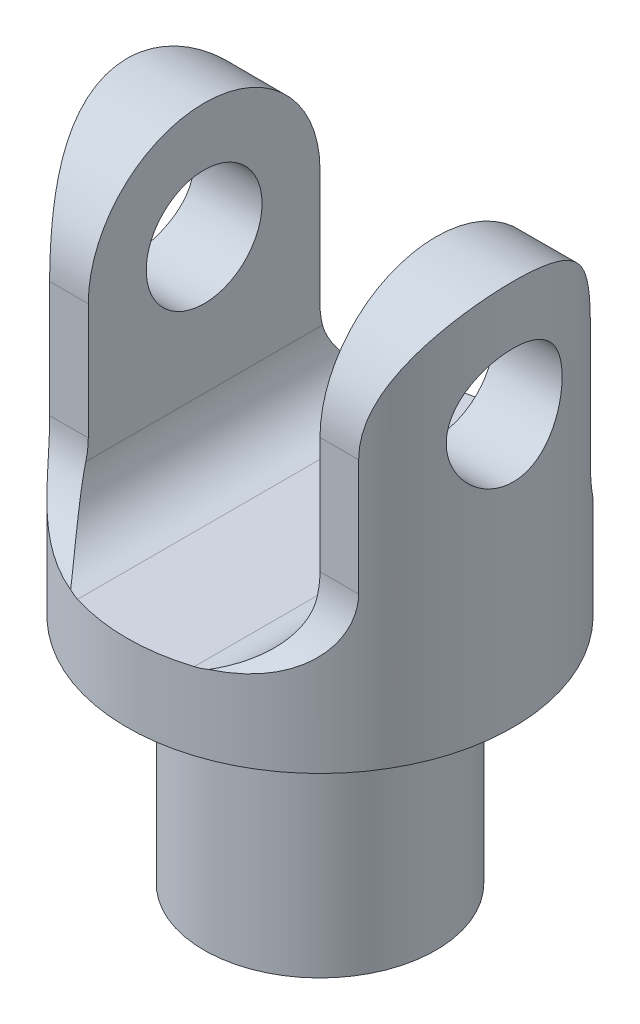
from build123d import *

# Parameters (mm, degrees)
CORTAR_EXTRUIR1_DEPTH      = 5
CORTAR_EXTRUIR1_DEPTH_BACK = 5
CROQUIS2_R                 = 1.5
CORTAR_EXTRUIR2_DEPTH      = 5
CORTAR_EXTRUIR2_DEPTH_BACK = 5


with BuildPart() as part:
    # Croquis1 → Revolución1 (revolve)
    with BuildSketch(Plane.XY):
        Polygon((3, 5), (5, 5), (5, -5), (3, -5), (3, -11), (0, -11), (0, -3), (0, 5), align=None)
    revolve(axis=Axis((0, -3, 0), (0, -1, 0)))

    # Croquis2 → Cortar-Extruir1 (cut, two sides: drawn at the far end of the back side and taken through both)
    with BuildSketch(Plane(origin=(0, 0, 0), x_dir=(0, 0, -1), z_dir=(1, 0, 0)).offset(-CORTAR_EXTRUIR1_DEPTH_BACK)):
        with BuildLine():
            Line((-5, 5), (-5, -3))
            Line((-5, -3), (-4.99, -3))
            ThreePointArc((-4.99, -3), (-3.582857505, -2.417142495), (-3, -1.01))
            Line((-3, -1.01), (-3, 2))
            ThreePointArc((-3, 2), (-2.121320344, 4.121320344), (0, 5))
            Line((0, 5), (-5, 5))
        make_face()
        with BuildLine():
            Line((5, 5), (0, 5))
            ThreePointArc((0, 5), (2.121320344, 4.121320344), (3, 2))
            Line((3, 2), (3, -1.01))
            ThreePointArc((3, -1.01), (3.582857505, -2.417142495), (4.99, -3))
            Line((4.99, -3), (5, -3))
            Line((5, -3), (5, 5))
        make_face()
        with Locations((0, 2)):
            Circle(CROQUIS2_R)
    extrude(amount=CORTAR_EXTRUIR1_DEPTH + CORTAR_EXTRUIR1_DEPTH_BACK, mode=Mode.SUBTRACT)

    # Croquis3 → Cortar-Extruir2 (cut, two sides: drawn at the far end of the back side and taken through both)
    with BuildSketch(Plane.XY.offset(-CORTAR_EXTRUIR2_DEPTH_BACK)):
        with BuildLine():
            Line((3, -1.51), (3, 5))
            Line((3, 5), (-3, 5))
            Line((-3, 5), (-3, -1.51))
            ThreePointArc((-3, -1.51), (-2.563589104, -2.563589104), (-1.51, -3))
            Line((-1.51, -3), (1.51, -3))
            ThreePointArc((1.51, -3), (2.563589104, -2.563589104), (3, -1.51))
        make_face()
    extrude(amount=CORTAR_EXTRUIR2_DEPTH + CORTAR_EXTRUIR2_DEPTH_BACK, mode=Mode.SUBTRACT)


solid = part.part
